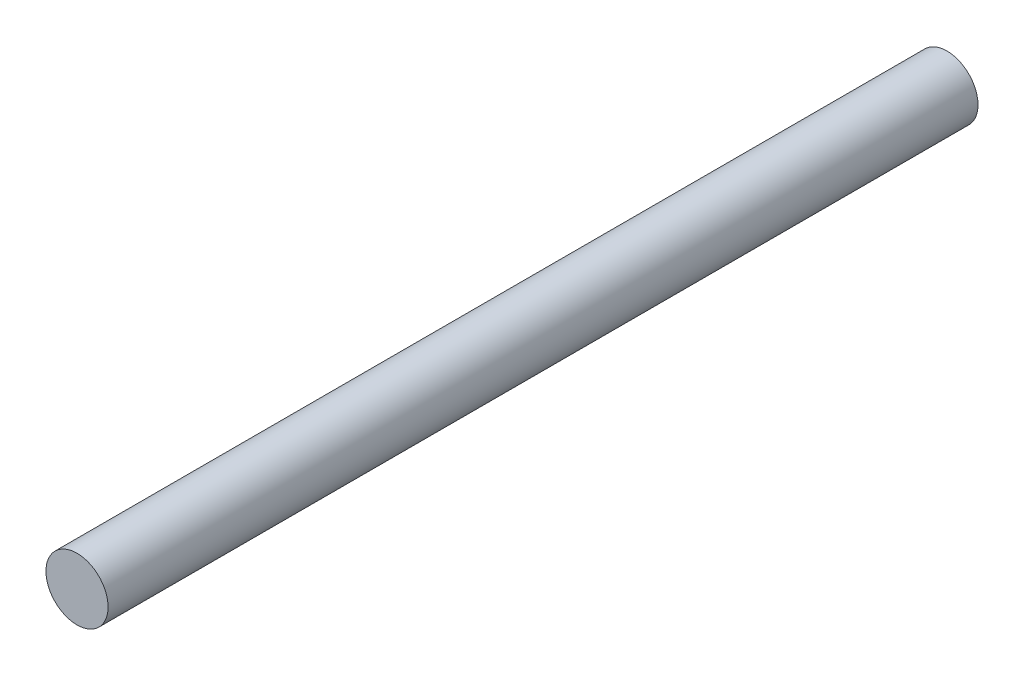
from build123d import *

# Parameters (mm, degrees)
SKETCH1_R  = 1.5875
BODY_DEPTH = 44.45


with BuildPart() as part:
    # Sketch1 → Body (new body)
    with BuildSketch(Plane.XY):
        Circle(SKETCH1_R)
    extrude(amount=-BODY_DEPTH)


solid = part.part
